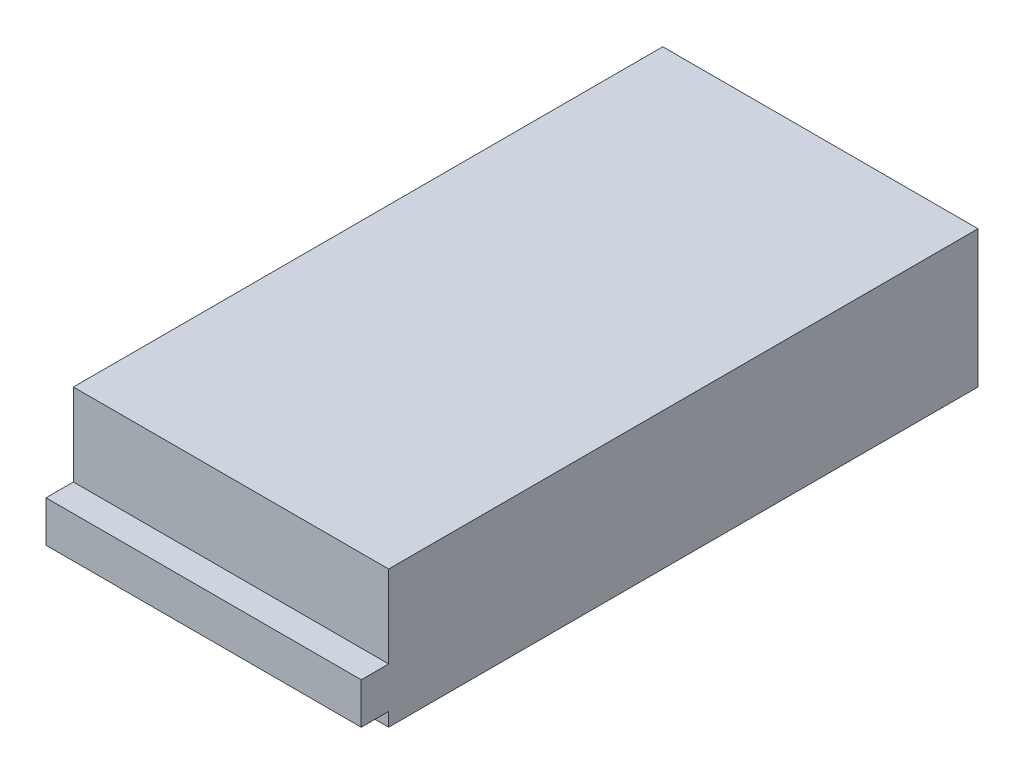
from build123d import *

# Parameters (mm, degrees)
SKETCH1_W           = 115
SKETCH1_H           = 215
BOSS_EXTRUDE1_DEPTH = 50
SKETCH2_W           = 115
SKETCH2_H           = 15
BOSS_EXTRUDE2_DEPTH = 10


with BuildPart() as part:
    # Sketch1 → Boss-Extrude1 (new body)
    with BuildSketch(Plane(origin=(0, 0, 0), x_dir=(1, 0, 0), z_dir=(0, 1, 0))):
        with Locations((57.5, 107.5)):
            Rectangle(SKETCH1_W, SKETCH1_H)
    extrude(amount=BOSS_EXTRUDE1_DEPTH)

    # Sketch2 → Boss-Extrude2 (add)
    with BuildSketch(Plane.XY):
        with Locations((57.5, 12.5)):
            Rectangle(SKETCH2_W, SKETCH2_H)
    extrude(amount=BOSS_EXTRUDE2_DEPTH)


solid = part.part
